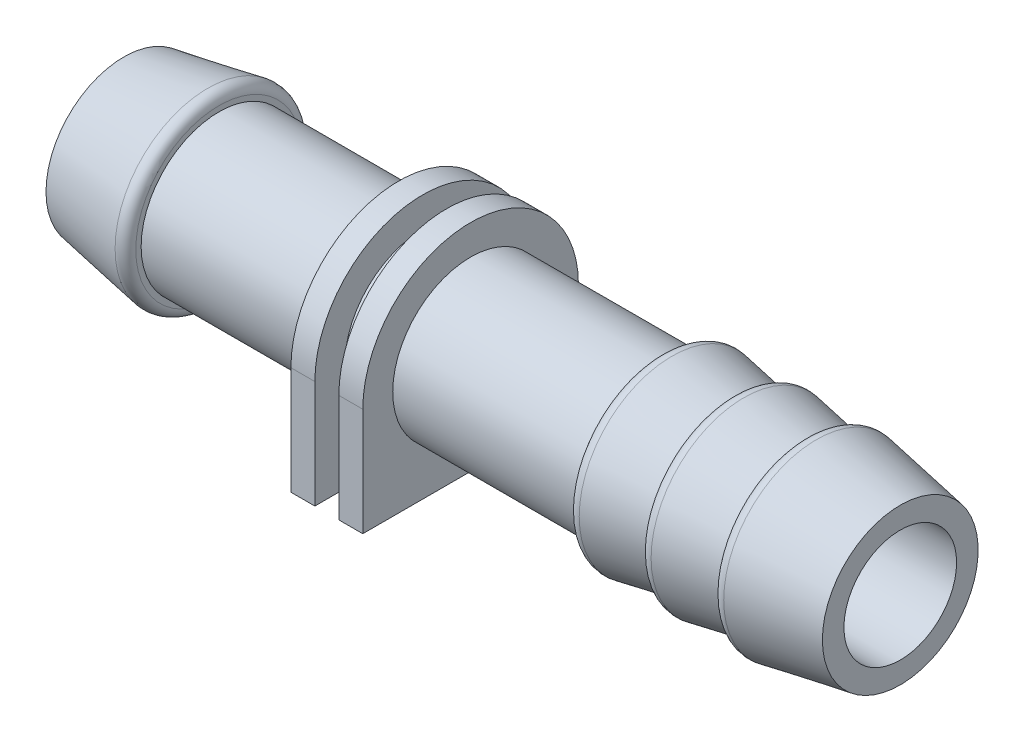
from build123d import *

# Parameters (mm, degrees)
BOSS_EXTRUDE1_DEPTH = 1
SKETCH2_R           = 2.35
CUT_EXTRUDE1_DEPTH  = 32.4
LPATTERN1_COUNT     = 2
LPATTERN1_PITCH     = 2


with BuildPart() as part:
    # Sketch1 → Revolve1 (revolve)
    with BuildSketch(Plane(origin=(0, 0, 0), x_dir=(1, 0, 0), z_dir=(0, 1, 0))):
        with BuildLine():
            Line((-18.91291866, 0), (13.48708134, 0))
            Line((13.48708134, 0), (13.48708134, -3.25))
            Line((13.48708134, -3.25), (9.986643337, -3.867221664))
            ThreePointArc((9.986643337, -3.867221664), (9.660069022, -3.77971634), (9.517184066, -3.473298563))
            Line((9.517184066, -3.473298563), (9.517184066, -3.415711135))
            Line((9.517184066, -3.415711135), (6.956540611, -3.867221664))
            ThreePointArc((6.956540611, -3.867221664), (6.629966296, -3.77971634), (6.48708134, -3.473298563))
            Line((6.48708134, -3.473298563), (6.48708134, -3.421019058))
            Line((6.48708134, -3.421019058), (3.956540611, -3.867221664))
            ThreePointArc((3.956540611, -3.867221664), (3.629966296, -3.77971634), (3.48708134, -3.473298563))
            Line((3.48708134, -3.473298563), (3.48708134, -3.25))
            Line((3.48708134, -3.25), (-14.943021387, -3.25))
            Line((-14.943021387, -3.25), (-14.943021387, -3.473298563))
            ThreePointArc((-14.943021387, -3.473298563), (-15.085906343, -3.77971634), (-15.412480658, -3.867221664))
            Line((-15.412480658, -3.867221664), (-18.91291866, -3.25))
            Line((-18.91291866, -3.25), (-18.91291866, 0))
        make_face()
    revolve(axis=Axis((-25.423923445, 0, 0), (1, 0, 0)))

    # Sketch3 → Boss-Extrude1 (add)
    with BuildSketch(Plane(origin=(-7.443021387, 0, 0), x_dir=(0, 0, -1), z_dir=(1, 0, 0))):
        with BuildLine():
            Line((4.5, -4.5), (-4.5, -4.5))
            Line((-4.5, -4.5), (-4.5, 0))
            ThreePointArc((-4.5, 0), (0, 4.5), (4.5, 0))
            Line((4.5, 0), (4.5, -4.5))
        make_face()
    boss_extrude1 = extrude(amount=BOSS_EXTRUDE1_DEPTH)

    # Sketch2 → Cut-Extrude1 (cut)
    with BuildSketch(Plane(origin=(13.48708134, 0, 0), x_dir=(0, 0, -1), z_dir=(1, 0, 0))):
        Circle(SKETCH2_R)
    extrude(amount=-CUT_EXTRUDE1_DEPTH, mode=Mode.SUBTRACT)

    # LPattern1: Boss-Extrude1 ×2
    with Locations(*[(i * LPATTERN1_PITCH, 0, 0) for i in range(1, LPATTERN1_COUNT)]):
        add(boss_extrude1)


solid = part.part
